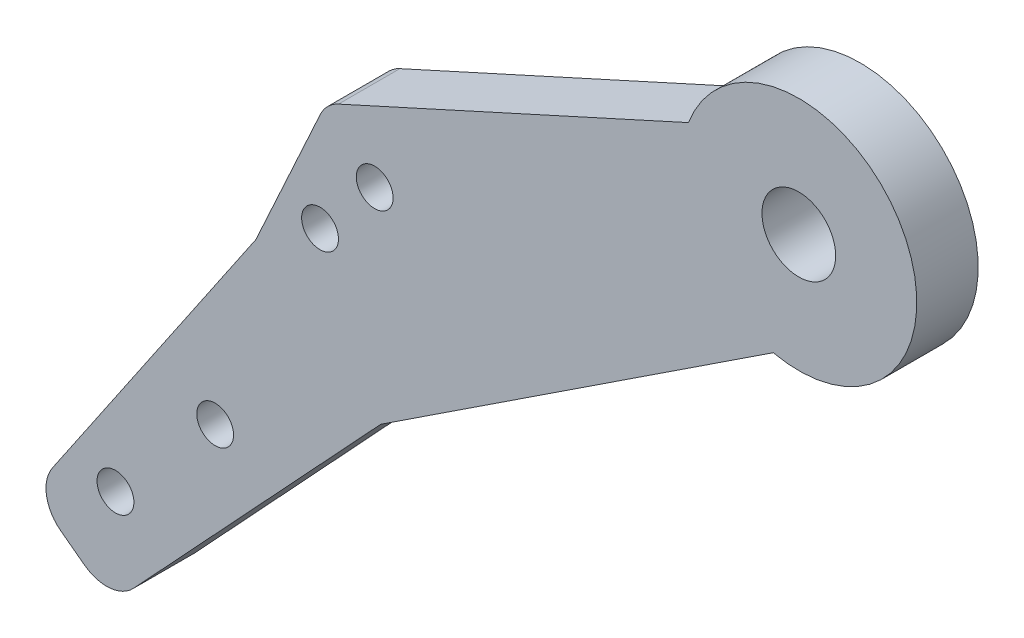
from build123d import *

# Parameters (mm, degrees)
SKETCH_1_R          = 1.5
EXTRUDE_1_DEPTH     = 5
FILLET_1_R          = 3
FILLET_2_R          = 3
FILLET_3_R          = 3
SKETCH_4_R          = 3
CUT_EXTRUDE_1_DEPTH = 82.164250349


with BuildPart() as part:
    # 草图1 → 凸台-拉伸1 (new body)
    with BuildSketch(Plane.XY):
        with BuildLine():
            Line((-2.080891717, -9.376881926), (-34.032481316, -30.39709937))
            Line((-34.032481316, -30.39709937), (-55.995404685, -53.998955167))
            Line((-55.995404685, -53.998955167), (-62.374359774, -49.211848164))
            Line((-62.374359774, -49.211848164), (-44.195107683, -22.4521745))
            Line((-44.195107683, -22.4521745), (-38.494818087, -10.008396594))
            Line((-38.494818087, -10.008396594), (-8.984967737, 3.395052247))
            ThreePointArc((-8.984967737, 3.395052247), (8.44949034, 4.567508949), (-2.080891717, -9.376881926))
        make_face()
        with Locations((-38.975543913, -19.061918057)):
            Circle(SKETCH_1_R, mode=Mode.SUBTRACT)
        with Locations((-34.52729214, -13.94289816)):
            Circle(SKETCH_1_R, mode=Mode.SUBTRACT)
        with Locations((-47.512706739, -37.147272562)):
            Circle(SKETCH_1_R, mode=Mode.SUBTRACT)
        with Locations((-55.63024758, -45.943962561)):
            Circle(SKETCH_1_R, mode=Mode.SUBTRACT)
    extrude(amount=EXTRUDE_1_DEPTH)

    # 圆角1
    fillet_1_edges = [part.edges().sort_by_distance(p)[0] for p in [
        (-55.995404685, -53.998955167, 2.5),
    ]]
    fillet(fillet_1_edges, radius=FILLET_1_R)

    # 圆角2
    fillet_2_edges = [part.edges().sort_by_distance(p)[0] for p in [
        (-62.374359774, -49.211848164, 2.5),
    ]]
    fillet(fillet_2_edges, radius=FILLET_2_R)

    # 圆角3
    fillet_3_edges = [part.edges().sort_by_distance(p)[0] for p in [
        (-38.494818087, -10.008396594, 2.5),
    ]]
    fillet(fillet_3_edges, radius=FILLET_3_R)

    # 草图4 → 切除-拉伸1 (cut, through all)
    with BuildSketch(Plane.XY.offset(5)):
        Circle(SKETCH_4_R)
    extrude(amount=-CUT_EXTRUDE_1_DEPTH, mode=Mode.SUBTRACT)


solid = part.part
